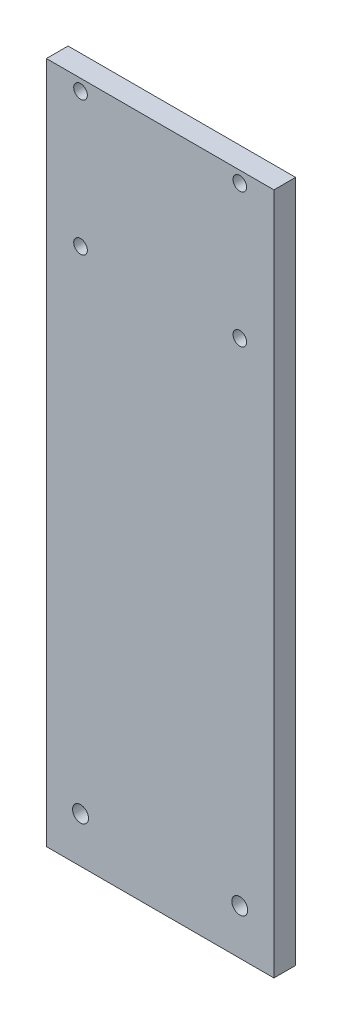
from build123d import *

# Parameters (mm, degrees)
SKETCH1_R           = 3
SKETCH1_R_2         = 3.5
BOSS_EXTRUDE1_DEPTH = 9.525


with BuildPart() as part:
    # Sketch1 → Boss-Extrude1 (new body)
    with BuildSketch(Plane.XY):
        Polygon((-27.364320758, 113.012415756), (72.635679242, 113.012415756), (72.635679242, 7.787512308), (72.635679242, -131.987584244), (72.635679242, -186.987584244), (-27.364320758, -186.987584244), (-27.364320758, -131.987584244), (-27.364320758, 7.787512308), align=None)
        with Locations(Location((-12.364320758, 108.012415756, 0), (0, 0, 180))):
            Circle(SKETCH1_R, mode=Mode.SUBTRACT)
        with Locations(Location((57.635679242, 49.012415756, 0), (0, 0, 180))):
            Circle(SKETCH1_R, mode=Mode.SUBTRACT)
        with Locations(Location((-12.364320758, 49.012415756, 0), (0, 0, 180))):
            Circle(SKETCH1_R, mode=Mode.SUBTRACT)
        with Locations(Location((57.635679242, 108.012415756, 0), (0, 0, 180))):
            Circle(SKETCH1_R, mode=Mode.SUBTRACT)
        with Locations(Location((-12.364320758, -166.987584244, 0), (0, 0, 180))):
            Circle(SKETCH1_R_2, mode=Mode.SUBTRACT)
        with Locations(Location((57.635679242, -166.987584244, 0), (0, 0, 180))):
            Circle(SKETCH1_R_2, mode=Mode.SUBTRACT)
    extrude(amount=BOSS_EXTRUDE1_DEPTH)


solid = part.part
